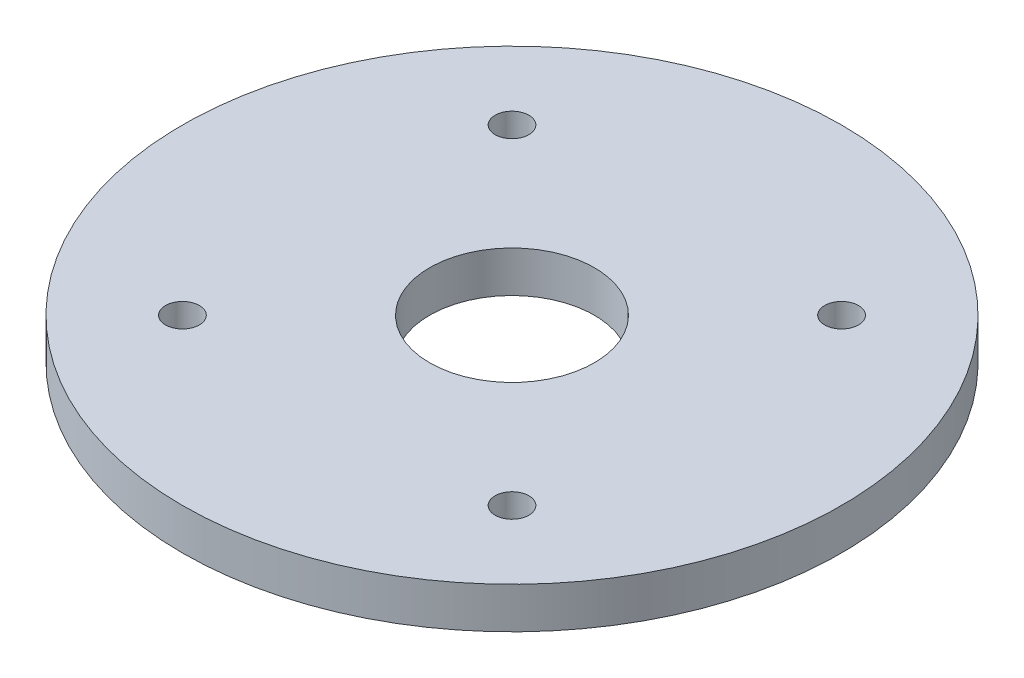
from build123d import *

# Parameters (mm, degrees)
SKETCH_1_R          = 20
SKETCH_1_R_2        = 5
EXTRUDE_1_DEPTH     = 2.5
HOLE_WIZARD_M2_51_D = 2.05


with BuildPart() as part:
    # Эскиз1 → Бобышка-Вытянуть1 (new body)
    with BuildSketch(Plane(origin=(0, 0, 0), x_dir=(1, 0, 0), z_dir=(0, 1, 0))):
        with Locations(Location((0, 0, 0), (0, 0, 270))):
            Circle(SKETCH_1_R)
        with Locations(Location((0, 0, 0), (0, 0, 270))):
            Circle(SKETCH_1_R_2, mode=Mode.SUBTRACT)
    extrude(amount=EXTRUDE_1_DEPTH)

    # Отверстие обработанное метчиком M2.51 (through all)
    with Locations(Plane(origin=(0, 2.5, 0), x_dir=(1, 0, 0), z_dir=(0, 1, 0))):
        with Locations((-10, 10), (10, 10), (10, -10), (-10, -10)):
            Hole(HOLE_WIZARD_M2_51_D / 2)


solid = part.part
